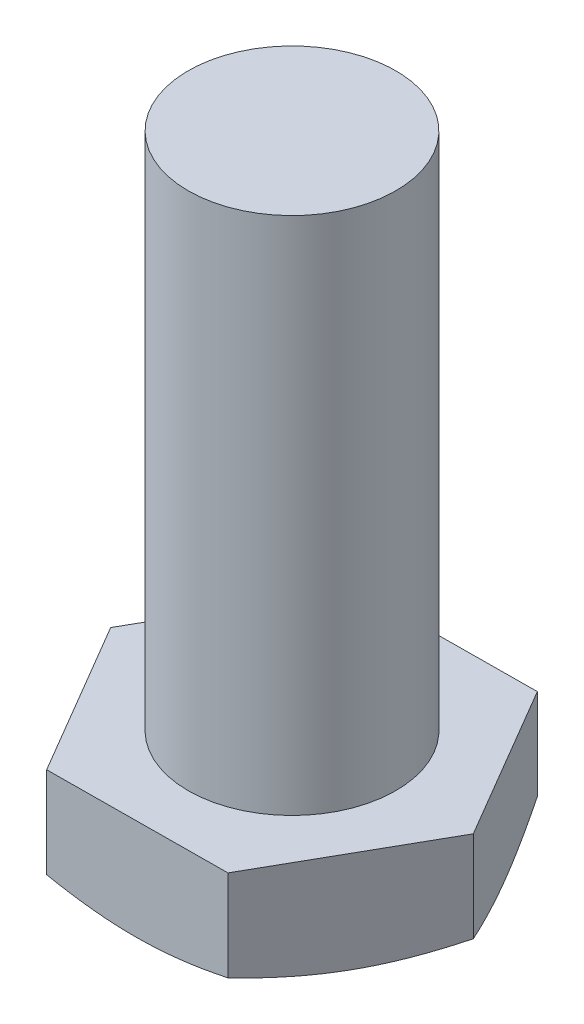
from build123d import *

# Parameters (mm, degrees)
EXTRUDE_1_DEPTH = 4
SKETCH_2_R      = 4
EXTRUDE_2_DEPTH = 20


with BuildPart() as part:
    # 草图1 → 凸台-拉伸1 (new body)
    with BuildSketch(Plane(origin=(0, 0, 0), x_dir=(1, 0, 0), z_dir=(0, 1, 0))):
        Polygon((3.419107318, 6.025753492), (-3.508901942, 5.973910542), (-6.92800926, -0.05184295), (-3.419107318, -6.025753492), (3.508901942, -5.973910542), (6.92800926, 0.05184295), align=None)
    extrude(amount=EXTRUDE_1_DEPTH)

    # 草图2 → 凸台-拉伸2 (add)
    with BuildSketch(Plane(origin=(0, 4, 0), x_dir=(1, 0, 0), z_dir=(0, 1, 0))):
        with Locations(Location((0, 0, 0), (0, 0, 270))):
            Circle(SKETCH_2_R)
    extrude(amount=EXTRUDE_2_DEPTH)

    # 草图5 → 切除-旋转3 (revolve, cut)
    with BuildSketch(Plane(origin=(0, 0, 0), x_dir=(0.4935056326713254, 0, -0.8697426001534447), z_dir=(0.8697426001534447, 0, 0.4935056326713254)), mode=Mode.PRIVATE) as cut_revolve_3_sk:
        Polygon((6.92820323, 0.5), (5.72820323, 0), (6.92820323, 0), align=None)
    revolve(cut_revolve_3_sk.sketch.rotate(Axis((0, -1000, 0), (0, 1, 0)), 179.999999998), axis=Axis((0, -1000, 0), (0, 1, 0)), mode=Mode.SUBTRACT)


solid = part.part
